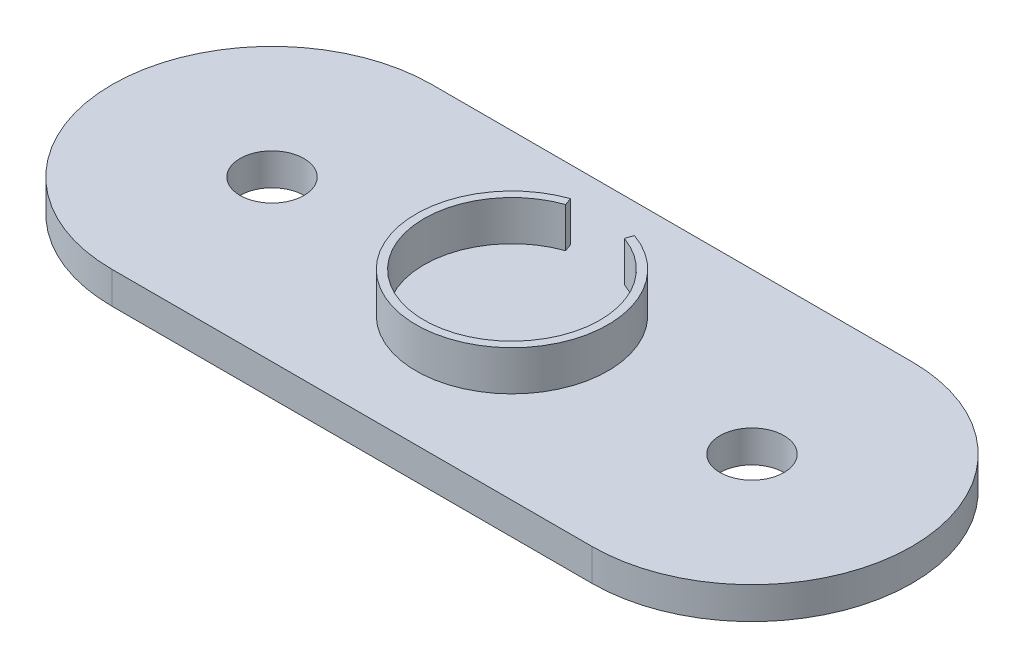
from build123d import *

# Parameters (mm, degrees)
EXTRUDE_1_DEPTH     = 2
SKETCH_2_R          = 2
CUT_EXTRUDE_1_DEPTH = 2
SKETCH_3_R          = 6
SKETCH_3_R_2        = 5.5
EXTRUDE_2_DEPTH     = 2.5
CUT_EXTRUDE_2_DEPTH = 2.5


with BuildPart() as part:
    # 草图1 → 凸台-拉伸1 (new body)
    with BuildSketch(Plane(origin=(0, 0, 0), x_dir=(1, 0, 0), z_dir=(0, 1, 0))):
        with BuildLine():
            Line((0, 10), (30, 10))
            ThreePointArc((30, 10), (40, 0), (30, -10))
            Line((30, -10), (0, -10))
            ThreePointArc((0, -10), (-10, 0), (0, 10))
        make_face()
    extrude(amount=EXTRUDE_1_DEPTH)

    # 草图2 → 切除-拉伸1 (cut)
    with BuildSketch(Plane(origin=(0, 2, 0), x_dir=(1, 0, 0), z_dir=(0, 1, 0))):
        with Locations(Location((0, 0, 0), (0, 0, 270))):
            Circle(SKETCH_2_R)
        with Locations(Location((30, 0, 0), (0, 0, 270))):
            Circle(SKETCH_2_R)
    extrude(amount=-CUT_EXTRUDE_1_DEPTH, mode=Mode.SUBTRACT)

    # 草图3 → 凸台-拉伸2 (add)
    with BuildSketch(Plane(origin=(0, 2, 0), x_dir=(1, 0, 0), z_dir=(0, 1, 0))):
        with Locations(Location((15, 0, 0), (0, 0, 270))):
            Circle(SKETCH_3_R)
        with Locations(Location((15, 0, 0), (0, 0, 270))):
            Circle(SKETCH_3_R_2, mode=Mode.SUBTRACT)
    extrude(amount=EXTRUDE_2_DEPTH)

    # 草图4 → 切除-拉伸2 (cut)
    with BuildSketch(Plane(origin=(0, 2, 0), x_dir=(1, 0, 0), z_dir=(0, 1, 0))):
        with BuildLine():
            Line((15, 0), (13, 5.656854249))
            ThreePointArc((13, 5.656854249), (15, 6), (17, 5.656854249))
            Line((17, 5.656854249), (15, 0))
        make_face()
    extrude(amount=CUT_EXTRUDE_2_DEPTH, mode=Mode.SUBTRACT)


solid = part.part
